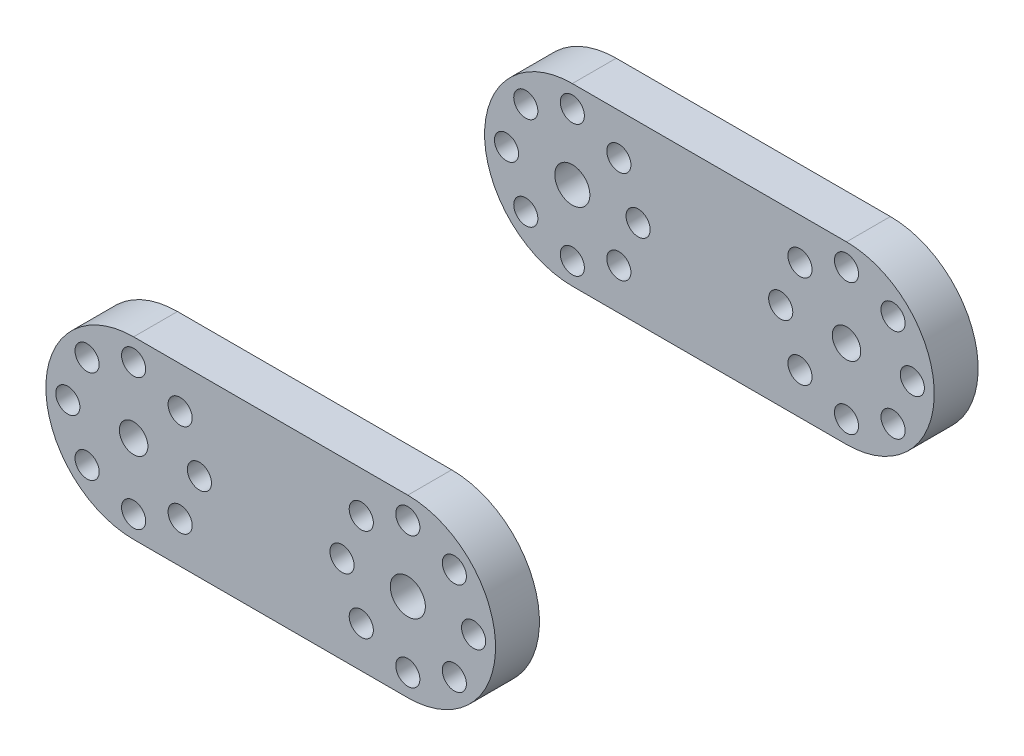
from build123d import *

# Parameters (mm, degrees)
SKETCH_1_R      = 1.3
SKETCH_1_R_2    = 1.6
SKETCH_1_R_3    = 1.1
EXTRUDE_1_DEPTH = 4
SKETCH_3_R      = 1.3
SKETCH_3_R_2    = 1.6
SKETCH_3_R_3    = 1.1
EXTRUDE_2_DEPTH = 4


with BuildPart() as part:
    # ｽｹｯﾁ1 → ﾎﾞｽ - 押し出し1 (new body)
    with BuildSketch(Plane.XY):
        with BuildLine():
            Line((0, 8), (25, 8))
            ThreePointArc((25, 8), (33, 0), (25, -8))
            Line((25, -8), (0, -8))
            ThreePointArc((0, -8), (-8, 0), (0, 8))
        make_face()
        Circle(SKETCH_1_R, mode=Mode.SUBTRACT)
        with Locations((25, 0)):
            Circle(SKETCH_1_R_2, mode=Mode.SUBTRACT)
        with Locations((0, 6)):
            Circle(SKETCH_1_R_3, mode=Mode.SUBTRACT)
        with Locations((4.242640687, 4.242640687)):
            Circle(SKETCH_1_R_3, mode=Mode.SUBTRACT)
        with Locations((6, 0)):
            Circle(SKETCH_1_R_3, mode=Mode.SUBTRACT)
        with Locations((4.242640687, -4.242640687)):
            Circle(SKETCH_1_R_3, mode=Mode.SUBTRACT)
        with Locations((0, -6)):
            Circle(SKETCH_1_R_3, mode=Mode.SUBTRACT)
        with Locations((-4.242640687, -4.242640687)):
            Circle(SKETCH_1_R_3, mode=Mode.SUBTRACT)
        with Locations((-6, 0)):
            Circle(SKETCH_1_R_3, mode=Mode.SUBTRACT)
        with Locations((-4.242640687, 4.242640687)):
            Circle(SKETCH_1_R_3, mode=Mode.SUBTRACT)
        with Locations((25, 6)):
            Circle(SKETCH_1_R_3, mode=Mode.SUBTRACT)
        with Locations((29.242640687, 4.242640687)):
            Circle(SKETCH_1_R_3, mode=Mode.SUBTRACT)
        with Locations((31, 0)):
            Circle(SKETCH_1_R_3, mode=Mode.SUBTRACT)
        with Locations((29.242640687, -4.242640687)):
            Circle(SKETCH_1_R_3, mode=Mode.SUBTRACT)
        with Locations((25, -6)):
            Circle(SKETCH_1_R_3, mode=Mode.SUBTRACT)
        with Locations((20.757359313, -4.242640687)):
            Circle(SKETCH_1_R_3, mode=Mode.SUBTRACT)
        with Locations((19, 0)):
            Circle(SKETCH_1_R_3, mode=Mode.SUBTRACT)
        with Locations((20.757359313, 4.242640687)):
            Circle(SKETCH_1_R_3, mode=Mode.SUBTRACT)
    extrude(amount=EXTRUDE_1_DEPTH)


with BuildPart() as body_2:
    # ｽｹｯﾁ3 → ﾎﾞｽ - 押し出し2 (new body)
    with BuildSketch(Plane(origin=(0, 0, -36), x_dir=(-1, 0, 0), z_dir=(0, 0, -1))):
        with BuildLine():
            Line((0, 8), (-25, 8))
            ThreePointArc((-25, 8), (-33, 0), (-25, -8))
            Line((-25, -8), (0, -8))
            ThreePointArc((0, -8), (8, 0), (0, 8))
        make_face()
        with Locations((-25, 0)):
            Circle(SKETCH_3_R, mode=Mode.SUBTRACT)
        Circle(SKETCH_3_R_2, mode=Mode.SUBTRACT)
        with Locations((-31, 0)):
            Circle(SKETCH_3_R_3, mode=Mode.SUBTRACT)
        with Locations((-29.242640687, 4.242640687)):
            Circle(SKETCH_3_R_3, mode=Mode.SUBTRACT)
        with Locations((-25, 6)):
            Circle(SKETCH_3_R_3, mode=Mode.SUBTRACT)
        with Locations((-29.242640687, -4.242640687)):
            Circle(SKETCH_3_R_3, mode=Mode.SUBTRACT)
        with Locations((4.242640687, -4.242640687)):
            Circle(SKETCH_3_R_3, mode=Mode.SUBTRACT)
        with Locations((6, 0)):
            Circle(SKETCH_3_R_3, mode=Mode.SUBTRACT)
        with Locations((4.242640687, 4.242640687)):
            Circle(SKETCH_3_R_3, mode=Mode.SUBTRACT)
        with Locations((0, 6)):
            Circle(SKETCH_3_R_3, mode=Mode.SUBTRACT)
        with Locations((-4.242640687, 4.242640687)):
            Circle(SKETCH_3_R_3, mode=Mode.SUBTRACT)
        with Locations((-6, 0)):
            Circle(SKETCH_3_R_3, mode=Mode.SUBTRACT)
        with Locations((-4.242640687, -4.242640687)):
            Circle(SKETCH_3_R_3, mode=Mode.SUBTRACT)
        with Locations((0, -6)):
            Circle(SKETCH_3_R_3, mode=Mode.SUBTRACT)
        with Locations((-25, -6)):
            Circle(SKETCH_3_R_3, mode=Mode.SUBTRACT)
        with Locations((-20.757359313, -4.242640687)):
            Circle(SKETCH_3_R_3, mode=Mode.SUBTRACT)
        with Locations((-19, 0)):
            Circle(SKETCH_3_R_3, mode=Mode.SUBTRACT)
        with Locations((-20.757359313, 4.242640687)):
            Circle(SKETCH_3_R_3, mode=Mode.SUBTRACT)
    extrude(amount=EXTRUDE_2_DEPTH)


solid = Compound([part.part, body_2.part])
